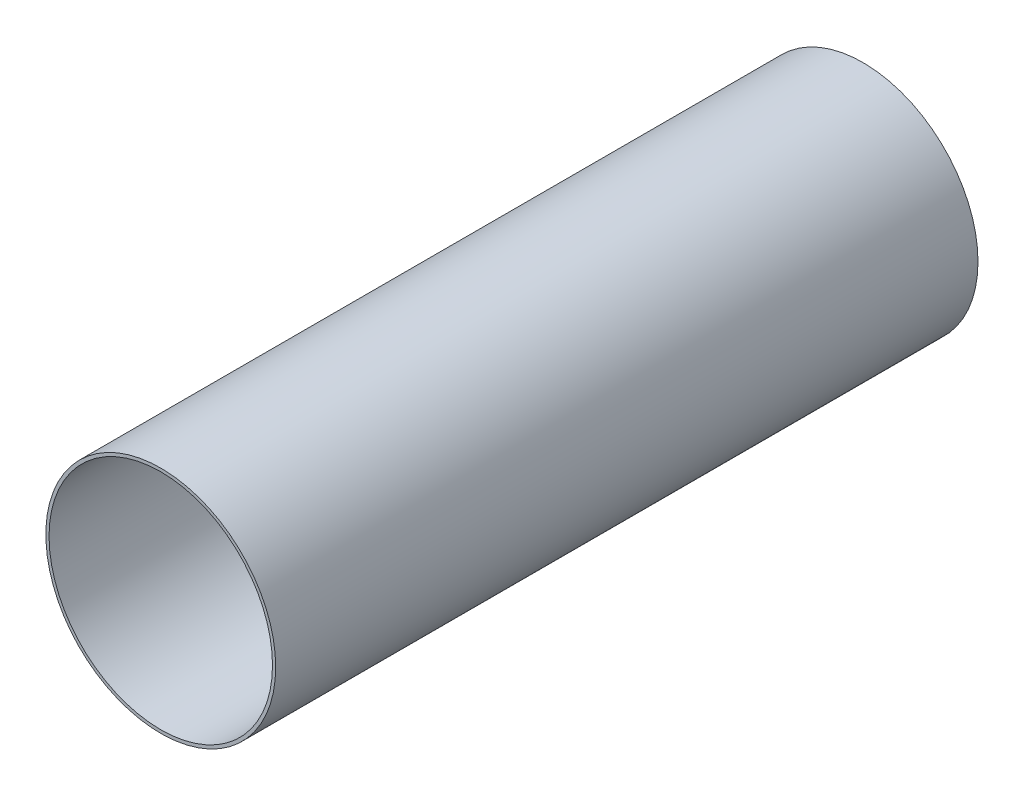
from build123d import *

# Parameters (mm, degrees)
SKETCH1_R           = 36
SKETCH1_R_2         = 35
BOSS_EXTRUDE1_DEPTH = 220


with BuildPart() as part:
    # Sketch1 → Boss-Extrude1 (new body)
    with BuildSketch(Plane.XY):
        Circle(SKETCH1_R)
        Circle(SKETCH1_R_2, mode=Mode.SUBTRACT)
    extrude(amount=BOSS_EXTRUDE1_DEPTH)


solid = part.part
